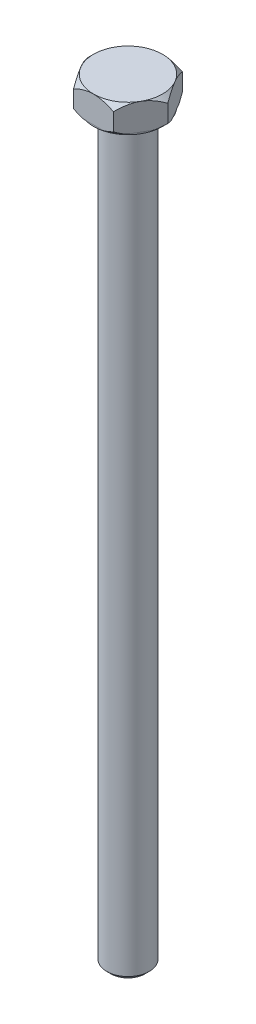
from build123d import *

# Parameters (mm, degrees)
BOSS_EXTRUDE1_DEPTH = 5.3
SKETCH2_OUTSIDE_W   = 21.122
SKETCH2_OUTSIDE_H   = 19.11
SKETCH2_OUTSIDE_R   = 6.5
CUT_EXTRUDE1_DEPTH  = 0.265
SKETCH3_R           = 4
BOSS_EXTRUDE2_DEPTH = 140
CHAMFER1_SIZE       = 0.8


with BuildPart() as part:
    # Sketch1 → Boss-Extrude1 (new body)
    with BuildSketch(Plane(origin=(0, 0, 0), x_dir=(1, 0, 0), z_dir=(0, 1, 0))):
        Polygon((7.505553499, 0), (3.75277675, 6.5), (-3.75277675, 6.5), (-7.505553499, 0), (-3.75277675, -6.5), (3.75277675, -6.5), align=None)
    extrude(amount=-BOSS_EXTRUDE1_DEPTH)

    # Sketch4 → Cut-Revolve1 (revolve, cut)
    with BuildSketch(Plane(origin=(0, 0, 0), x_dir=(0, 0, -1), z_dir=(1, 0, 0))):
        Polygon((-6.5, 0), (-8.15, 0), (-8.15, -1.65), align=None)
        Polygon((-8.15, -3.65), (-6.5, -5.3), (-8.15, -5.3), align=None)
    revolve(axis=Axis((0, 0, 0), (0, -1, 0)), mode=Mode.SUBTRACT)

    # Sketch2 outside → Cut-Extrude1 (cut)
    with BuildSketch(Plane.XZ.offset(5.3)):
        Rectangle(SKETCH2_OUTSIDE_W, SKETCH2_OUTSIDE_H)
        with Locations(Location((0, 0, 0), (0, 0, 90))):
            Circle(SKETCH2_OUTSIDE_R, mode=Mode.SUBTRACT)
    extrude(amount=-CUT_EXTRUDE1_DEPTH, mode=Mode.SUBTRACT)

    # Sketch3 → Boss-Extrude2 (add)
    with BuildSketch(Plane.XZ.offset(5.3)):
        with Locations(Location((0, 0, 0), (0, 0, 90))):
            Circle(SKETCH3_R)
    extrude(amount=BOSS_EXTRUDE2_DEPTH)

    # Chamfer1
    chamfer1_edges = [part.edges().sort_by_distance(p)[0] for p in [
        (0, -145.3, -4),
    ]]
    chamfer(chamfer1_edges, length=CHAMFER1_SIZE)


solid = part.part
